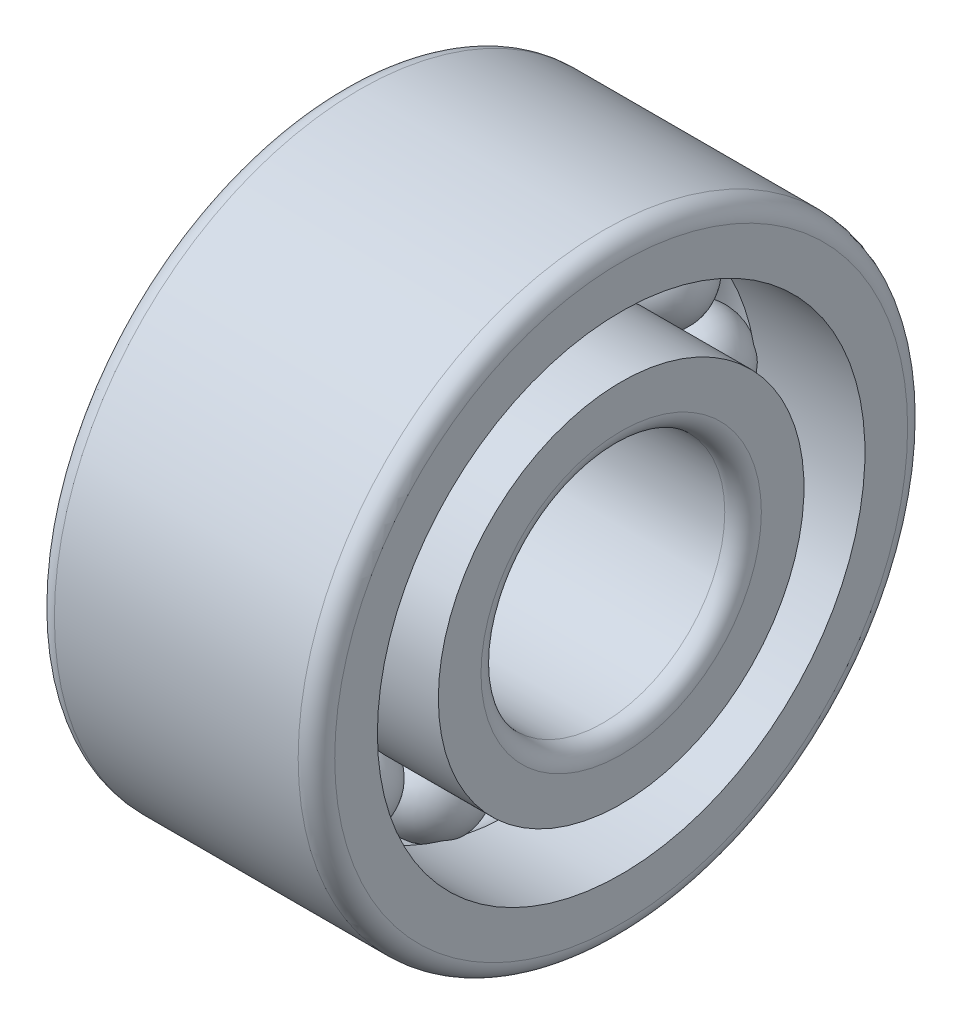
from build123d import *

# Parameters (mm, degrees)
CIRCULAR_PATTERN1_COUNT = 13
FILLET1_R               = 0.15


with BuildPart() as part:
    # Sketch1 → Revolve1 (revolve)
    with BuildSketch(Plane.XY):
        with BuildLine():
            Line((-0.375, 1.75), (0.375, 1.75))
            ThreePointArc((0.375, 1.75), (0, 2.125), (-0.375, 1.75))
        make_face()
    revolve1 = revolve(axis=Axis((-4.596602, 1.75, 0), (1, 0, 0)))

    # Sketch2 → Revolve2 (revolve)
    with BuildSketch(Plane.XY, mode=Mode.PRIVATE) as revolve2_sk:
        with BuildLine():
            Line((-1.15, 1.5), (-1.15, 1))
            Line((-1.15, 1), (1.15, 1))
            Line((1.15, 1), (1.15, 1.5))
            Line((1.15, 1.5), (0.265942, 1.5))
            ThreePointArc((0.265942, 1.5), (0, 1.385), (-0.265942, 1.5))
            Line((-0.265942, 1.5), (-1.15, 1.5))
        make_face()
    revolve(revolve2_sk.sketch.rotate(Axis((-6.97139, 0, 0), (1, 0, 0)), 90), axis=Axis((-6.97139, 0, 0), (1, 0, 0)))

    # Sketch3 → Revolve3 (revolve)
    with BuildSketch(Plane.XY, mode=Mode.PRIVATE) as revolve3_sk:
        with BuildLine():
            Line((-1.15, 2.5), (1.15, 2.5))
            Line((1.15, 2.5), (1.15, 2))
            Line((1.15, 2), (0.265942, 2))
            ThreePointArc((0.265942, 2), (0, 2.115), (-0.265942, 2))
            Line((-0.265942, 2), (-1.15, 2))
            Line((-1.15, 2), (-1.15, 2.5))
        make_face()
    revolve(revolve3_sk.sketch.rotate(Axis((-8.710676, 0, 0), (1, 0, 0)), 90), axis=Axis((-8.710676, 0, 0), (1, 0, 0)))

    # Circular-Pattern1: Revolve1 ×13 about axis
    circular_pattern1_axis = Axis((0, 0, 0), (1, 0, 0))
    for i in range(1, CIRCULAR_PATTERN1_COUNT):
        add(revolve1.rotate(circular_pattern1_axis, i * 360 / CIRCULAR_PATTERN1_COUNT))

    # Fillet1
    fillet1_edges = [part.edges().sort_by_distance(p)[0] for p in [
        (-1.15, 0, -2.5),
        (1.15, 0, -2.5),
        (-1.15, 0, -1),
        (1.15, 0, -1),
    ]]
    fillet(fillet1_edges, radius=FILLET1_R)


solid = part.part
